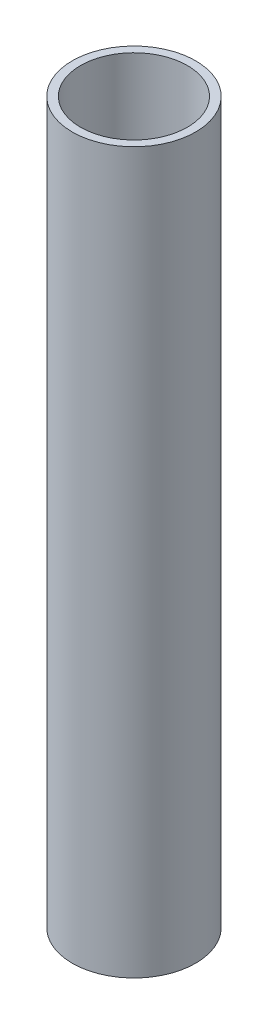
from build123d import *

# Parameters (mm, degrees)
SKETCH1_R           = 3
SKETCH1_R_2         = 2.6
BOSS_EXTRUDE1_DEPTH = 35


with BuildPart() as part:
    # Sketch1 → Boss-Extrude1 (new body)
    with BuildSketch(Plane(origin=(0, 0, 0), x_dir=(1, 0, 0), z_dir=(0, 1, 0))):
        with Locations(Location((0, 0, 0), (0, 0, 270))):
            Circle(SKETCH1_R)
        with Locations(Location((0, 0, 0), (0, 0, 270))):
            Circle(SKETCH1_R_2, mode=Mode.SUBTRACT)
    extrude(amount=BOSS_EXTRUDE1_DEPTH)


solid = part.part
